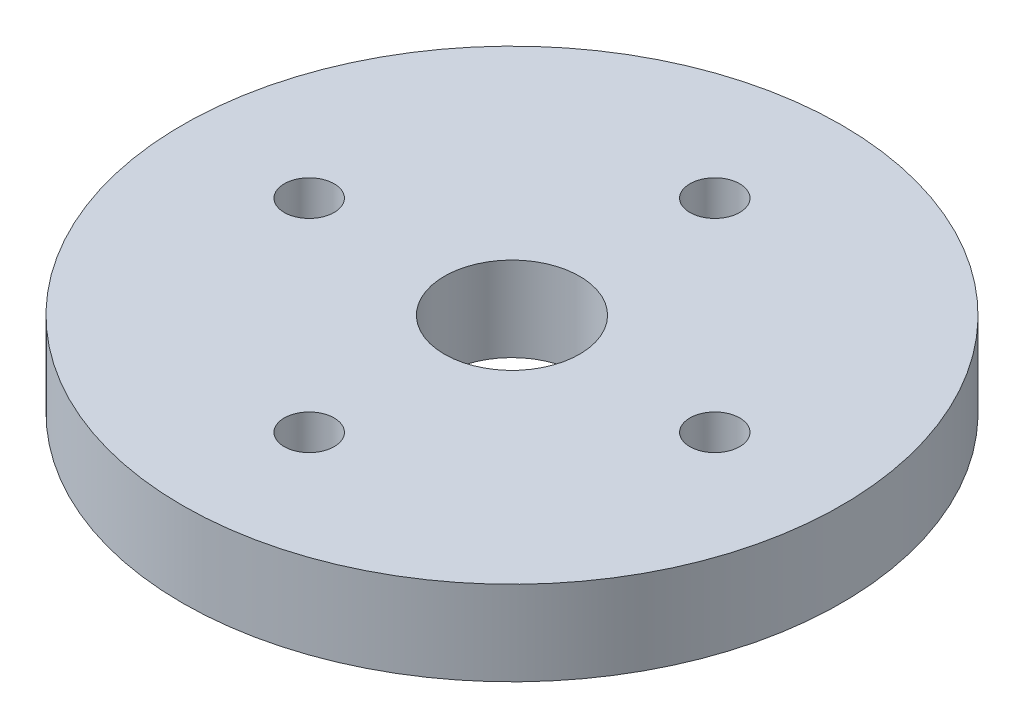
from build123d import *

# Parameters (mm, degrees)
SKETCH1_R           = 19.5
SKETCH1_R_2         = 4
SKETCH1_R_3         = 1.475
BOSS_EXTRUDE1_DEPTH = 5


with BuildPart() as part:
    # Sketch1 → Boss-Extrude1 (new body)
    with BuildSketch(Plane(origin=(0, 0, 0), x_dir=(1, 0, 0), z_dir=(0, 1, 0))):
        with Locations(Location((0, 0, 0), (0, 0, 270))):
            Circle(SKETCH1_R)
        with Locations(Location((0, 0, 0), (0, 0, 270))):
            Circle(SKETCH1_R_2, mode=Mode.SUBTRACT)
        with Locations(Location((0, 12, 0), (0, 0, 270))):
            Circle(SKETCH1_R_3, mode=Mode.SUBTRACT)
        with Locations(Location((-12, 0, 0), (0, 0, 270))):
            Circle(SKETCH1_R_3, mode=Mode.SUBTRACT)
        with Locations(Location((12, 0, 0), (0, 0, 90))):
            Circle(SKETCH1_R_3, mode=Mode.SUBTRACT)
        with Locations(Location((0, -12, 0), (0, 0, 90))):
            Circle(SKETCH1_R_3, mode=Mode.SUBTRACT)
    extrude(amount=BOSS_EXTRUDE1_DEPTH)


solid = part.part
